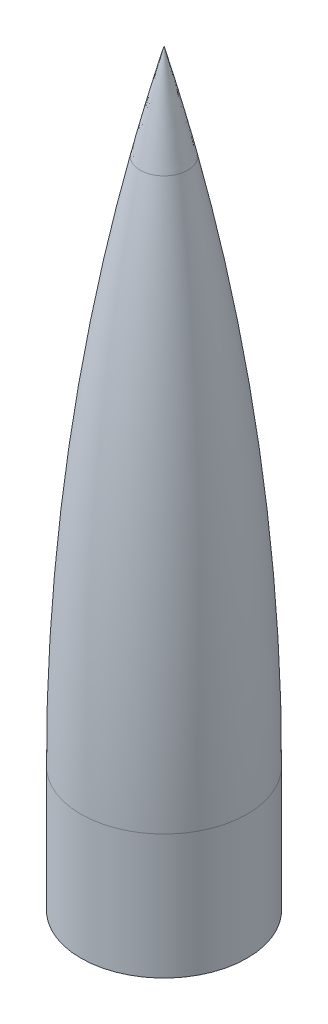
from build123d import *


with BuildPart() as part:
    # Sketch1 → Revolve4 (revolve)
    with BuildSketch(Plane.XY, mode=Mode.PRIVATE) as revolve4_sk:
        with BuildLine():
            Line((-50.8, 76.2), (-50.8, 0))
            Line((-50.8, 0), (-49.53, 0))
            Line((-49.53, 0), (-49.53, 76.2))
            ThreePointArc((-49.53, 76.2), (-40.43567342, 238.505956843), (-13.266545858, 398.78))
            Line((-13.266545858, 398.78), (-14.569026637, 398.78))
            ThreePointArc((-14.569026637, 398.78), (-41.71386971, 238.504143378), (-50.8, 76.2))
        make_face()
    revolve(revolve4_sk.sketch.rotate(Axis((0, 0, 0), (0, 1, 0)), 270), axis=Axis((0, 0, 0), (0, 1, 0)))


with BuildPart() as body_2:
    # Sketch4 → Revolve5 (revolve)
    with BuildSketch(Plane.XY, mode=Mode.PRIVATE) as revolve5_sk:
        with BuildLine():
            Line((0, 398.78), (0, 457.2))
            ThreePointArc((0, 457.2), (-7.58690655, 428.065412103), (-14.569026637, 398.78))
            Line((-14.569026637, 398.78), (0, 398.78))
        make_face()
    revolve(revolve5_sk.sketch.rotate(Axis((0, 398.78, 0), (0, -1, 0)), 90), axis=Axis((0, 398.78, 0), (0, -1, 0)))


solid = Compound([part.part, body_2.part])
